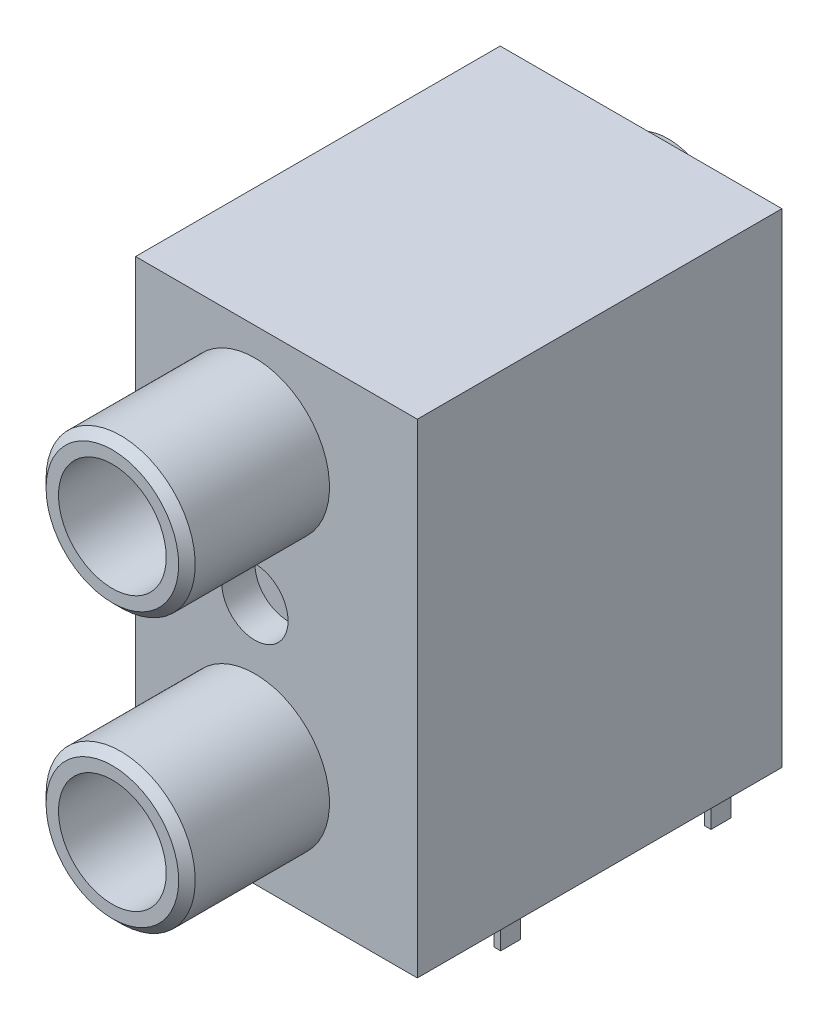
from build123d import *

# Parameters (mm, degrees)
SKETCH1_W                  = 17
SKETCH1_H                  = 22
BOSS_EXTRUDE1_DEPTH        = 29.2
SKETCH3_R                  = 4
BOSS_EXTRUDE2_DEPTH        = 2.94
BOSS_EXTRUDE2_TAPER        = 10
SKETCH4_R                  = 4.5
BOSS_EXTRUDE3_DEPTH        = 8.6
CHAMFER1_SIZE              = 0.5
SKETCH13_R                 = 3.25
CUT_EXTRUDE1_DEPTH         = 29
SKETCH14_W                 = 0.4
SKETCH14_H                 = 1.2
BOSS_EXTRUDE4_DEPTH        = 3.25
LPATTERN1_COUNT            = 2
LPATTERN1_PITCH            = 16.5
CHAMFER1_OF_LPATTERN1_SIZE = 0.5
LPATTERN2_COUNT            = 2
LPATTERN2_PITCH            = 3.17
LPATTERN2_COUNT_DIR2       = 2
LPATTERN2_PITCH_DIR2       = 1.27
SKETCH15_R                 = 2
CUT_EXTRUDE2_DEPTH         = 2


with BuildPart() as part:
    # Sketch1 → Boss-Extrude1 (new body)
    with BuildSketch(Plane(origin=(0, 0, 0), x_dir=(1, 0, 0), z_dir=(0, 1, 0))):
        with Locations((-7.350772662, 1.631732914)):
            Rectangle(SKETCH1_W, SKETCH1_H)
    extrude(amount=BOSS_EXTRUDE1_DEPTH)

    # Sketch3 → Boss-Extrude2 (add)
    with BuildSketch(Plane(origin=(0, 0, -12.631732914), x_dir=(-1, 0, 0), z_dir=(0, 0, -1))):
        with Locations((8.650772662, 6.5)):
            Circle(SKETCH3_R)
    boss_extrude2 = extrude(amount=BOSS_EXTRUDE2_DEPTH, taper=BOSS_EXTRUDE2_TAPER)

    # Sketch4 → Boss-Extrude3 (add)
    with BuildSketch(Plane.XY.offset(9.368267086)):
        with Locations(Location((-8.650772662, 6.5, 0), (0, 0, 180))):
            Circle(SKETCH4_R)
    boss_extrude3 = extrude(amount=BOSS_EXTRUDE3_DEPTH)

    # Chamfer1
    chamfer1_edges = [part.edges().sort_by_distance(p)[0] for p in [
        (-4.150772662, 6.5, 17.968267086),
    ]]
    chamfer(chamfer1_edges, length=CHAMFER1_SIZE)

    # Sketch13 → Cut-Extrude1 (cut)
    with BuildSketch(Plane.XY.offset(17.968267086)):
        with Locations((-8.650772662, 6.5)):
            Circle(SKETCH13_R)
    cut_extrude1 = extrude(amount=-CUT_EXTRUDE1_DEPTH, mode=Mode.SUBTRACT)

    # Sketch14 → Boss-Extrude4 (add)
    with BuildSketch(Plane.XZ):
        with Locations((-13.900772662, 4.758267086)):
            Rectangle(SKETCH14_W, SKETCH14_H)
        with Locations((-2.470772662, 4.758267086)):
            Rectangle(SKETCH14_W, SKETCH14_H)
        with Locations((-2.470772662, -7.931732914)):
            Rectangle(SKETCH14_W, SKETCH14_H)
        with Locations((-13.900772662, -7.931732914)):
            Rectangle(SKETCH14_W, SKETCH14_H)
    boss_extrude4 = extrude(amount=BOSS_EXTRUDE4_DEPTH)

    # LPattern1: Boss-Extrude2, Boss-Extrude3, Cut-Extrude1 ×2
    with Locations(*[(0, i * LPATTERN1_PITCH, 0) for i in range(1, LPATTERN1_COUNT)]):
        add(boss_extrude2)
        add(boss_extrude3)
        add(cut_extrude1, mode=Mode.SUBTRACT)

    # Chamfer1 of LPattern1
    chamfer1_of_lpattern1_edges = [part.edges().sort_by_distance(p)[0] for p in [
        (-4.150772662, 23, 17.968267086),
    ]]
    chamfer(chamfer1_of_lpattern1_edges, length=CHAMFER1_OF_LPATTERN1_SIZE)

    # LPattern2: Boss-Extrude4 2 × 2, 2 skipped
    with Locations(*[(j * LPATTERN2_PITCH_DIR2, 0, -i * LPATTERN2_PITCH) for i in range(LPATTERN2_COUNT) for j in range(LPATTERN2_COUNT_DIR2) if (i, j) not in ((0, 0), (0, 1), (1, 0))]):
        add(boss_extrude4)

    # Sketch15 → Cut-Extrude2 (cut)
    with BuildSketch(Plane.XY.offset(9.368267086)):
        with Locations((-8.650772662, 14.75)):
            Circle(SKETCH15_R)
    extrude(amount=-CUT_EXTRUDE2_DEPTH, mode=Mode.SUBTRACT)


solid = part.part
